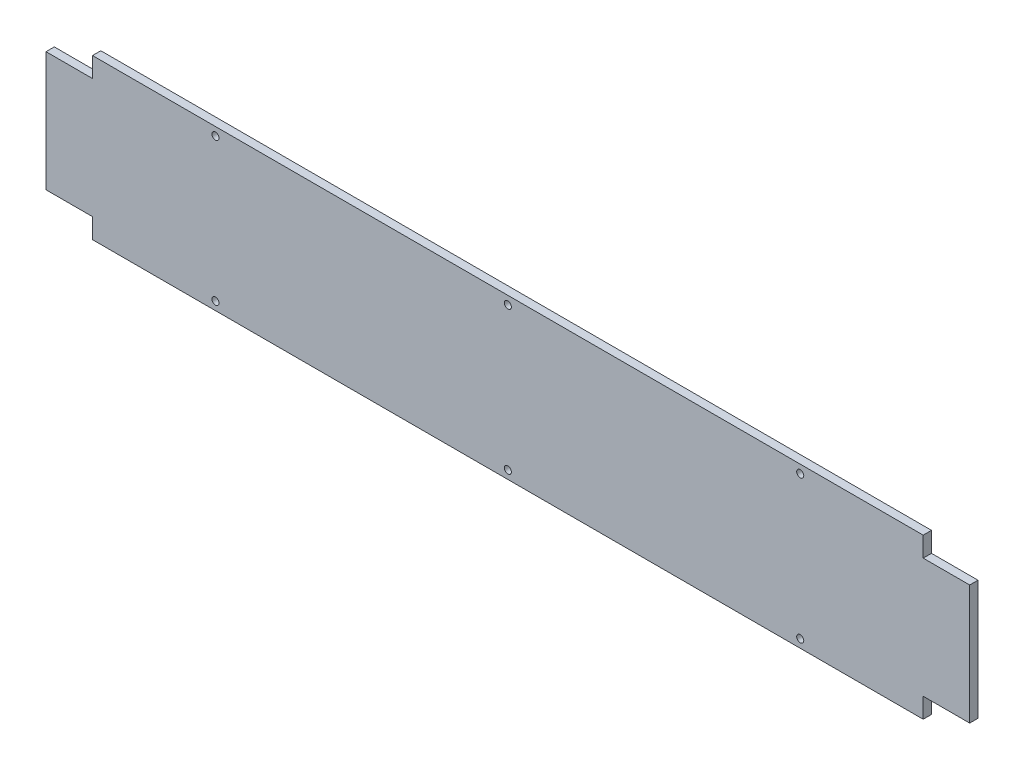
from build123d import *

# Parameters (mm, degrees)
SKETCH1_W           = 500
SKETCH1_H           = 96
BOSS_EXTRUDE1_DEPTH = 5
SKETCH2_R           = 2.125
CUT_EXTRUDE1_DEPTH  = 5
SKETCH3_W           = 28
SKETCH3_H           = 72
BOSS_EXTRUDE2_DEPTH = 5


with BuildPart() as part:
    # Sketch1 → Boss-Extrude1 (new body)
    with BuildSketch(Plane.XY):
        with Locations((250, 48)):
            Rectangle(SKETCH1_W, SKETCH1_H)
    extrude(amount=BOSS_EXTRUDE1_DEPTH)

    # Sketch2 → Cut-Extrude1 (cut)
    with BuildSketch(Plane.XY.offset(5)):
        with Locations((74, 91)):
            Circle(SKETCH2_R)
        with Locations((250, 91)):
            Circle(SKETCH2_R)
        with Locations((426, 91)):
            Circle(SKETCH2_R)
        with Locations(Location((426, 5, 0), (0, 0, 180))):
            Circle(SKETCH2_R)
        with Locations(Location((250, 5, 0), (0, 0, 180))):
            Circle(SKETCH2_R)
        with Locations(Location((74, 5, 0), (0, 0, 180))):
            Circle(SKETCH2_R)
    extrude(amount=-CUT_EXTRUDE1_DEPTH, mode=Mode.SUBTRACT)

    # Sketch3 → Boss-Extrude2 (add)
    with BuildSketch(Plane.XY.offset(5)):
        with Locations((514, 48)):
            Rectangle(SKETCH3_W, SKETCH3_H)
        with Locations((-14, 48)):
            Rectangle(SKETCH3_W, SKETCH3_H)
    extrude(amount=-BOSS_EXTRUDE2_DEPTH)


solid = part.part
